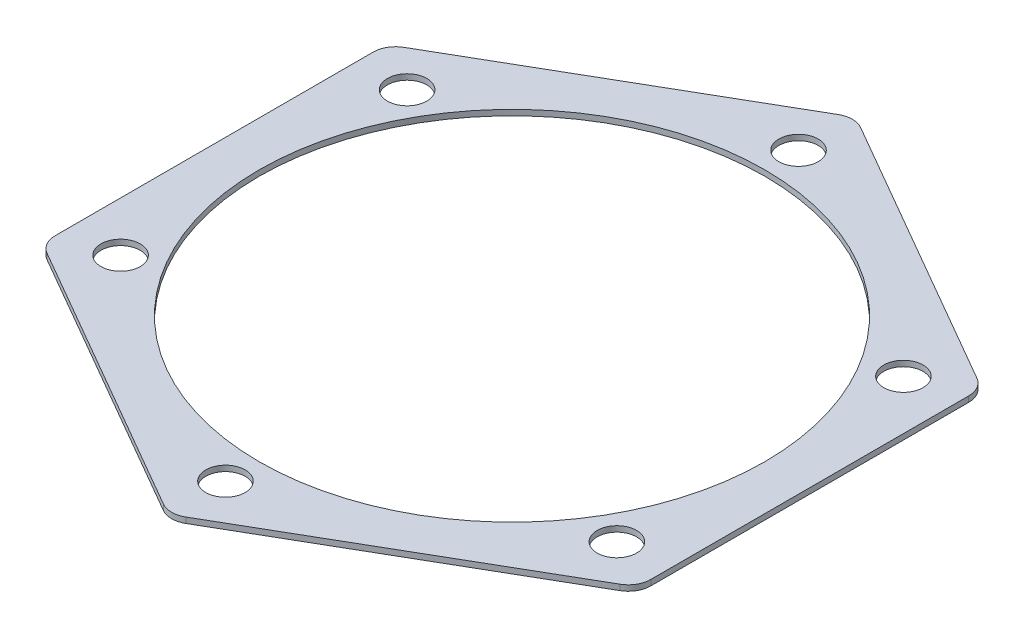
from build123d import *

# Parameters (mm, degrees)
BOSS_EXTRUDE1_DEPTH = 1
SKETCH2_R           = 3.5
CUT_EXTRUDE1_DEPTH  = 81.498297773
SKETCH3_R           = 45
CUT_EXTRUDE2_DEPTH  = 81.498297773


with BuildPart() as part:
    # Sketch1 → Boss-Extrude1 (new body)
    with BuildSketch(Plane(origin=(0, 0, 0), x_dir=(1, 0, 0), z_dir=(0, 1, 0))):
        with BuildLine():
            Line((2, -60.044427996), (51, -31.754264805))
            ThreePointArc((51, -31.754264805), (52.464101615, -30.29016319), (53, -28.29016319))
            Line((53, -28.29016319), (53, 28.29016319))
            ThreePointArc((53, 28.29016319), (52.464101615, 30.29016319), (51, 31.754264805))
            Line((51, 31.754264805), (2, 60.044427996))
            ThreePointArc((2, 60.044427996), (0, 60.580326381), (-2, 60.044427996))
            Line((-2, 60.044427996), (-51, 31.754264805))
            ThreePointArc((-51, 31.754264805), (-52.464101615, 30.29016319), (-53, 28.29016319))
            Line((-53, 28.29016319), (-53, -28.29016319))
            ThreePointArc((-53, -28.29016319), (-52.464101615, -30.29016319), (-51, -31.754264805))
            Line((-51, -31.754264805), (-2, -60.044427996))
            ThreePointArc((-2, -60.044427996), (0, -60.580326381), (2, -60.044427996))
        make_face()
    extrude(amount=BOSS_EXTRUDE1_DEPTH)

    # Sketch2 → Cut-Extrude1 (cut, through all)
    with BuildSketch(Plane(origin=(0, 1, 0), x_dir=(1, 0, 0), z_dir=(0, 1, 0))):
        with Locations(Location((0, 51, 0), (0, 0, 270))):
            Circle(SKETCH2_R)
        with Locations(Location((44.167295593, 25.5, 0), (0, 0, 270))):
            Circle(SKETCH2_R)
        with Locations(Location((44.167295593, -25.5, 0), (0, 0, 270))):
            Circle(SKETCH2_R)
        with Locations(Location((0, -51, 0), (0, 0, 270))):
            Circle(SKETCH2_R)
        with Locations(Location((-44.167295593, -25.5, 0), (0, 0, 270))):
            Circle(SKETCH2_R)
        with Locations(Location((-44.167295593, 25.5, 0), (0, 0, 270))):
            Circle(SKETCH2_R)
    extrude(amount=-CUT_EXTRUDE1_DEPTH, mode=Mode.SUBTRACT)

    # Sketch3 → Cut-Extrude2 (cut, through all)
    with BuildSketch(Plane.XZ):
        with Locations(Location((0, 0, 0), (0, 0, 270))):
            Circle(SKETCH3_R)
    extrude(amount=-CUT_EXTRUDE2_DEPTH, mode=Mode.SUBTRACT)


solid = part.part
